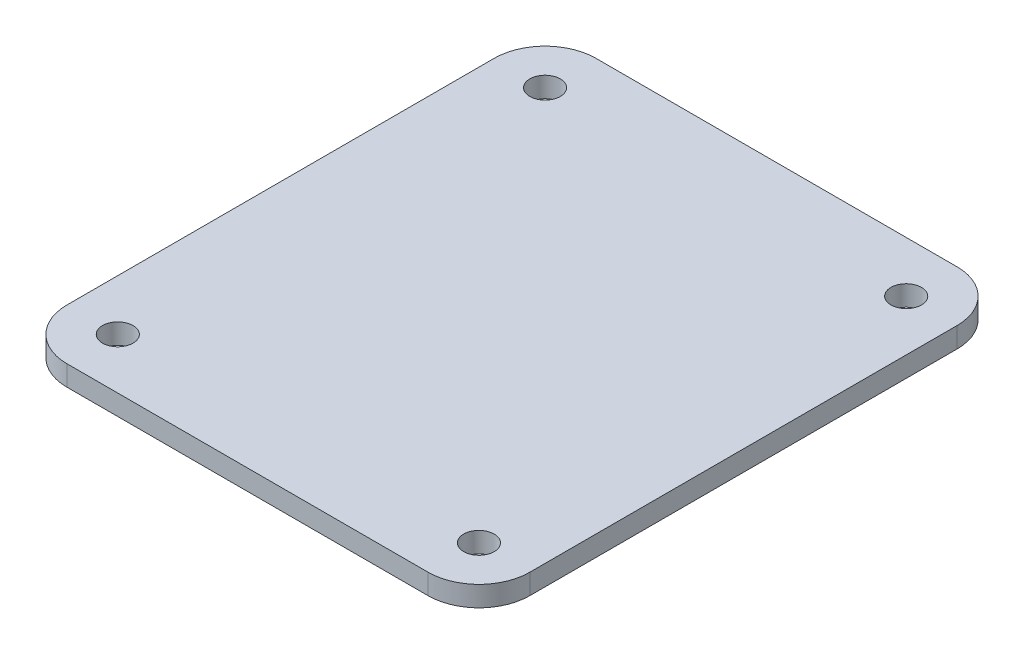
from build123d import *

# Parameters (mm, degrees)
SKETCH_1_R      = 1.5
EXTRUDE_1_DEPTH = 2


with BuildPart() as part:
    # 草圖1 → 填料-伸長1 (new body)
    with BuildSketch(Plane(origin=(0, 0, 0), x_dir=(1, 0, 0), z_dir=(0, 1, 0))):
        with BuildLine():
            Line((-17.75, 26), (17.75, 26))
            ThreePointArc((17.75, 26), (21.285533906, 24.535533906), (22.75, 21))
            Line((22.75, 21), (22.75, -21))
            ThreePointArc((22.75, -21), (21.285533906, -24.535533906), (17.75, -26))
            Line((17.75, -26), (-17.75, -26))
            ThreePointArc((-17.75, -26), (-21.285533906, -24.535533906), (-22.75, -21))
            Line((-22.75, -21), (-22.75, 21))
            ThreePointArc((-22.75, 21), (-21.285533906, 24.535533906), (-17.75, 26))
        make_face()
        with Locations(Location((17.75, 21, 0), (0, 0, 270))):
            Circle(SKETCH_1_R, mode=Mode.SUBTRACT)
        with Locations(Location((-17.75, 21, 0), (0, 0, 270))):
            Circle(SKETCH_1_R, mode=Mode.SUBTRACT)
        with Locations(Location((-17.75, -21, 0), (0, 0, 270))):
            Circle(SKETCH_1_R, mode=Mode.SUBTRACT)
        with Locations(Location((17.75, -21, 0), (0, 0, 270))):
            Circle(SKETCH_1_R, mode=Mode.SUBTRACT)
    extrude(amount=EXTRUDE_1_DEPTH)


solid = part.part
